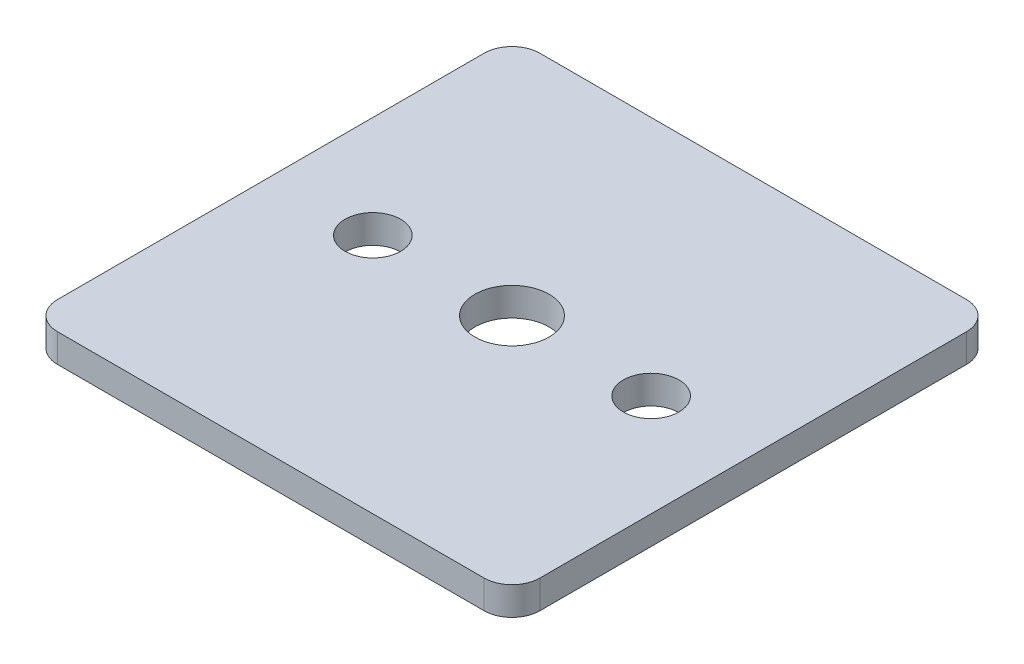
from build123d import *

# Parameters (mm, degrees)
SKETCH2_W           = 26
SKETCH2_H           = 26
SKETCH2_R           = 1.5
SKETCH2_R_2         = 2
BOSS_EXTRUDE1_DEPTH = 1.529434596
FILLET1_R           = 1.5


with BuildPart() as part:
    # Sketch2 → Boss-Extrude1 (new body)
    with BuildSketch(Plane(origin=(0, 0, 0), x_dir=(1, 0, 0), z_dir=(0, 1, 0))):
        Rectangle(SKETCH2_W, SKETCH2_H)
        with Locations(Location((7.5, 0, 0), (0, 0, 270))):
            Circle(SKETCH2_R, mode=Mode.SUBTRACT)
        with Locations(Location((-7.5, 0, 0), (0, 0, 270))):
            Circle(SKETCH2_R, mode=Mode.SUBTRACT)
        with Locations(Location((0, 0, 0), (0, 0, 270))):
            Circle(SKETCH2_R_2, mode=Mode.SUBTRACT)
    extrude(amount=BOSS_EXTRUDE1_DEPTH)

    # Fillet1
    fillet1_edges = [part.edges().sort_by_distance(p)[0] for p in [
        (-13, 0.764717298, -13),
        (13, 0.764717298, -13),
        (13, 0.764717298, 13),
        (-13, 0.764717298, 13),
    ]]
    fillet(fillet1_edges, radius=FILLET1_R)


solid = part.part
